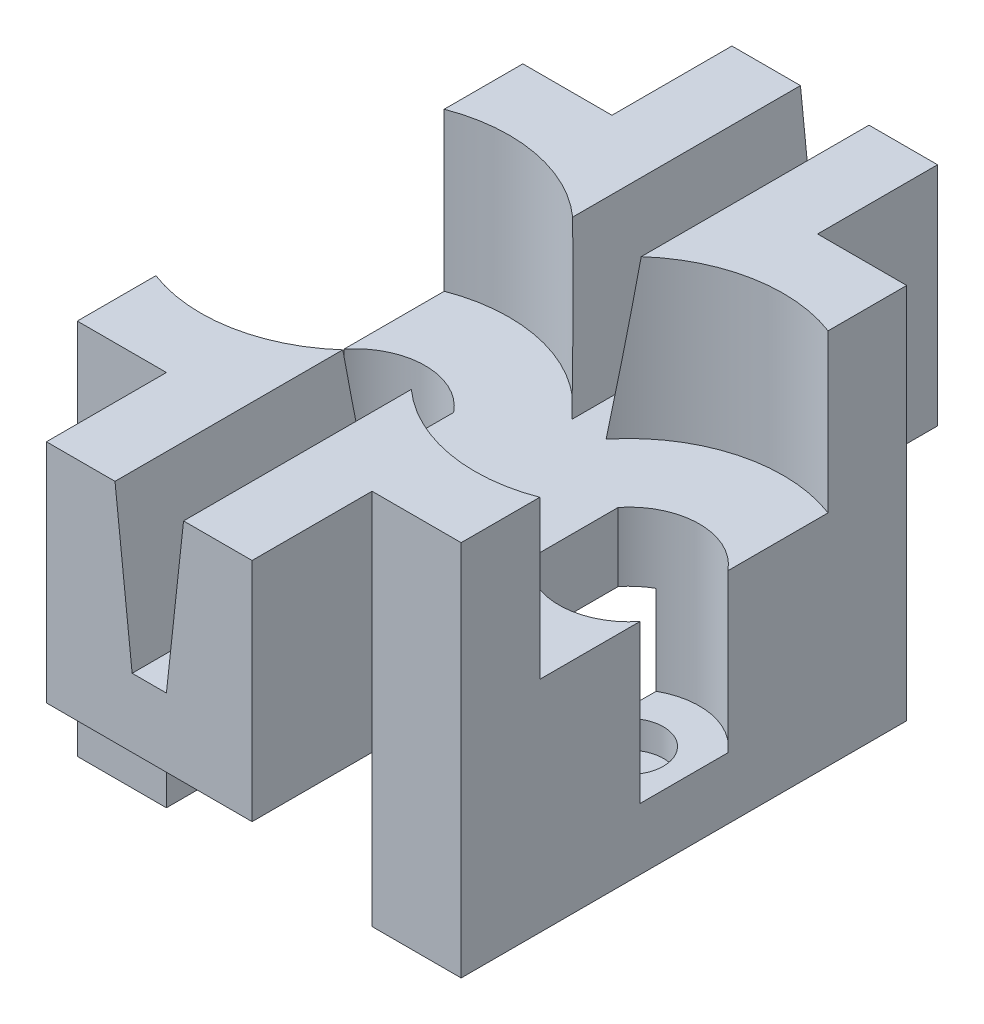
from build123d import *

# Parameters (mm, degrees)
SKETCH1_W           = 56
SKETCH1_H           = 100
BOSS_EXTRUDE1_DEPTH = 55
CUT_EXTRUDE2_DEPTH  = 118.511701545
SKETCH7_R           = 22.5
SKETCH7_R_2         = 10
CUT_EXTRUDE4_DEPTH  = 23
CUT_EXTRUDE5_DEPTH  = 46
CUT_EXTRUDE6_DEPTH  = 4
CUT_EXTRUDE7_DEPTH  = 23
SKETCH12_W          = 13
SKETCH12_H          = 17.5
CUT_EXTRUDE8_DEPTH  = 80.429213769
SKETCH13_W          = 30
SKETCH13_H          = 22
CUT_EXTRUDE9_DEPTH  = 118.511701545


with BuildPart() as part:
    # Sketch1 → Boss-Extrude1 (new body)
    with BuildSketch(Plane(origin=(0, 0, 0), x_dir=(1, 0, 0), z_dir=(0, 1, 0))):
        Rectangle(SKETCH1_W, SKETCH1_H)
    extrude(amount=BOSS_EXTRUDE1_DEPTH)

    # Sketch3 → Cut-Extrude2 (cut, through all)
    with BuildSketch(Plane.XY.offset(50)):
        Polygon((-2.5, 32), (-5, 55), (5, 55), (2.5, 32), align=None)
    extrude(amount=-CUT_EXTRUDE2_DEPTH, mode=Mode.SUBTRACT)

    # Sketch7 → Cut-Extrude4 (cut)
    with BuildSketch(Plane(origin=(0, 55, 0), x_dir=(1, 0, 0), z_dir=(0, 1, 0))):
        with Locations((20, 0)):
            Circle(SKETCH7_R)
        with Locations((20, 0)):
            Circle(SKETCH7_R_2, mode=Mode.SUBTRACT)
    cut_extrude4 = extrude(amount=-CUT_EXTRUDE4_DEPTH, mode=Mode.SUBTRACT)

    # Sketch9 → Cut-Extrude5 (cut)
    with BuildSketch(Plane(origin=(0, 55, 0), x_dir=(1, 0, 0), z_dir=(0, 1, 0))):
        with BuildLine():
            Line((12, 6.408002809), (12, -6.408002809))
            ThreePointArc((12, -6.408002809), (30.25, 0), (12, 6.408002809))
        make_face()
    cut_extrude5 = extrude(amount=-CUT_EXTRUDE5_DEPTH, mode=Mode.SUBTRACT)

    # Sketch10 → Cut-Extrude6 (cut)
    with BuildSketch(Plane(origin=(0, 9, 0), x_dir=(1, 0, 0), z_dir=(0, 1, 0))):
        with BuildLine():
            Line((16, 3), (16, -3))
            ThreePointArc((16, -3), (25, 0), (16, 3))
        make_face()
    cut_extrude6 = extrude(amount=-CUT_EXTRUDE6_DEPTH, mode=Mode.SUBTRACT)

    # Sketch11 → Cut-Extrude7 (cut)
    with BuildSketch(Plane(origin=(0, 55, 0), x_dir=(1, 0, 0), z_dir=(0, 1, 0))):
        with BuildLine():
            Line((12, 6.408002809), (12, -6.408002809))
            ThreePointArc((12, -6.408002809), (9.677076266, 0), (12, 6.408002809))
        make_face()
    cut_extrude7 = extrude(amount=-CUT_EXTRUDE7_DEPTH, mode=Mode.SUBTRACT)

    # Mirror1: Cut-Extrude4, Cut-Extrude5, Cut-Extrude6, Cut-Extrude7 across plane
    add(cut_extrude4.mirror(Plane(origin=(0, 0, 0), x_dir=(0, 0, 1), z_dir=(1, 0, 0))), mode=Mode.SUBTRACT)
    add(cut_extrude5.mirror(Plane(origin=(0, 0, 0), x_dir=(0, 0, 1), z_dir=(1, 0, 0))), mode=Mode.SUBTRACT)
    add(cut_extrude6.mirror(Plane(origin=(0, 0, 0), x_dir=(0, 0, 1), z_dir=(1, 0, 0))), mode=Mode.SUBTRACT)
    add(cut_extrude7.mirror(Plane(origin=(0, 0, 0), x_dir=(0, 0, 1), z_dir=(1, 0, 0))), mode=Mode.SUBTRACT)

    # Sketch12 → Cut-Extrude8 (cut, through all)
    with BuildSketch(Plane(origin=(0, 55, 0), x_dir=(1, 0, 0), z_dir=(0, 1, 0))):
        with Locations((-21.5, 41.25)):
            Rectangle(SKETCH12_W, SKETCH12_H)
        with Locations((21.5, 41.25)):
            Rectangle(SKETCH12_W, SKETCH12_H)
        with Locations((-21.5, -41.25)):
            Rectangle(SKETCH12_W, SKETCH12_H)
        with Locations((21.5, -41.25)):
            Rectangle(SKETCH12_W, SKETCH12_H)
    extrude(amount=-CUT_EXTRUDE8_DEPTH, mode=Mode.SUBTRACT)

    # Sketch13 → Cut-Extrude9 (cut, through all)
    with BuildSketch(Plane.XY.offset(50)):
        with Locations((0, 11)):
            Rectangle(SKETCH13_W, SKETCH13_H)
    extrude(amount=-CUT_EXTRUDE9_DEPTH, mode=Mode.SUBTRACT)


solid = part.part
